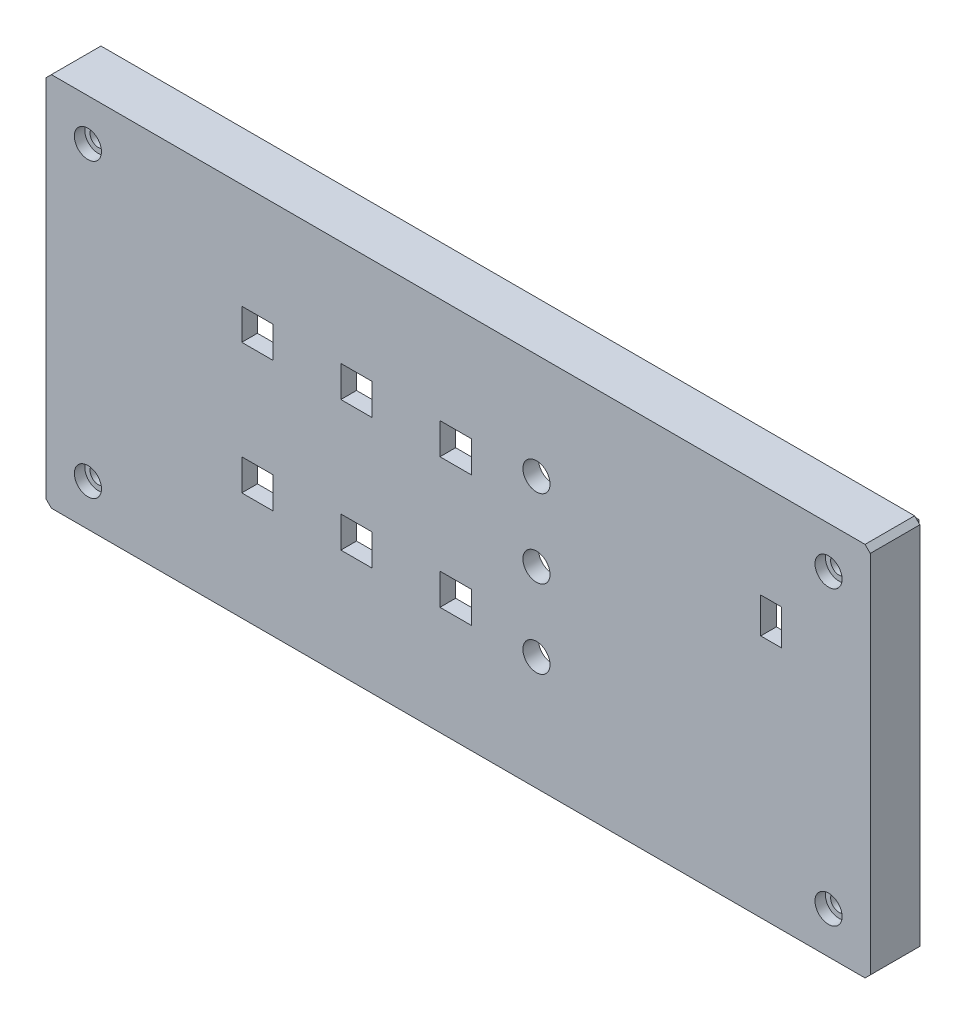
from build123d import *

# Parameters (mm, degrees)
SKETCH1_W                 = 158
SKETCH1_H                 = 72
SKETCH1_W_2               = 154
SKETCH1_H_2               = 68
BOSS_EXTRUDE1_DEPTH       = 6.5
SKETCH2_W                 = 158
SKETCH2_H                 = 72
BOSS_EXTRUDE2_DEPTH       = 3
SKETCH3_W                 = 6
SKETCH3_H                 = 6
SKETCH3_R                 = 2.6
CUT_EXTRUDE1_DEPTH        = 88.334128495
SKETCH5_W                 = 4
SKETCH5_H                 = 6.8
CUT_EXTRUDE7_DEPTH        = 3
SKETCH6_W                 = 155.6
SKETCH6_H                 = 69.6
SKETCH6_W_2               = 154
SKETCH6_H_2               = 68
BOSS_EXTRUDE3_DEPTH       = 1
SKETCH7_W                 = 10.3
SKETCH7_H                 = 10.3
SKETCH7_W_2               = 8.3
SKETCH7_H_2               = 8.3
BOSS_EXTRUDE4_DEPTH       = 1
LPATTERN1_COUNT           = 3
LPATTERN1_PITCH           = 19
LPATTERN1_COUNT_DIR2      = 2
LPATTERN1_PITCH_DIR2      = 25
SKETCH1_3_R               = 3
SKETCH1_3_R_2             = 1.6
BOSS_EXTRUDE5_DEPTH       = 6.5
CUT_EXTRUDE8_DEPTH        = 88.334128495
CUT_EXTRUDE8_DEPTH_BACK   = 88.334128495
SKETCH1_4_R               = 1.6
CHAMFER1_SIZE             = 1
CUT_EXTRUDE9_START        = -2
SKETCH8_R                 = 2.6
SKETCH8_R_2               = 1.6
CUT_EXTRUDE9_DEPTH        = 2
LPATTERN2_COUNT           = 2
LPATTERN2_PITCH           = 142
LPATTERN2_COUNT_DIR2      = 2
LPATTERN2_PITCH_DIR2      = 56
RIB1_REACH                = 104.114
SKETCH10_WALL_W           = 210.13293881
SKETCH10_WALL_H           = 2
CIRPATTERN1_COUNT         = 4
LPATTERN3_COUNT           = 2
LPATTERN3_PITCH           = 56
LPATTERN3_COUNT_DIR2      = 2
LPATTERN3_PITCH_DIR2      = 142
LPATTERN3_COPY_1_REACH    = 104.114
LPATTERN3_COPY_1_SKETCH_W = 210.13293881
LPATTERN3_COPY_1_SKETCH_H = 2
LPATTERN3_COPY_2_REACH    = 104.114
LPATTERN3_COPY_2_SKETCH_W = 210.13293881
LPATTERN3_COPY_2_SKETCH_H = 2
LPATTERN3_COPY_3_REACH    = 104.114
LPATTERN3_COPY_3_SKETCH_W = 210.13293881
LPATTERN3_COPY_3_SKETCH_H = 2
LPATTERN3_COPY_4_REACH    = 104.114
LPATTERN3_COPY_4_SKETCH_W = 210.13293881
LPATTERN3_COPY_4_SKETCH_H = 2
LPATTERN3_COPY_5_REACH    = 104.114
LPATTERN3_COPY_5_SKETCH_W = 210.13293881
LPATTERN3_COPY_5_SKETCH_H = 2
LPATTERN3_COPY_6_REACH    = 104.114
LPATTERN3_COPY_6_SKETCH_W = 210.13293881
LPATTERN3_COPY_6_SKETCH_H = 2
LPATTERN3_COPY_7_REACH    = 104.114
LPATTERN3_COPY_7_SKETCH_W = 210.13293881
LPATTERN3_COPY_7_SKETCH_H = 2
LPATTERN3_COPY_8_REACH    = 104.114
LPATTERN3_COPY_8_SKETCH_W = 210.13293881
LPATTERN3_COPY_8_SKETCH_H = 2
LPATTERN3_COPY_9_REACH    = 104.114
LPATTERN3_COPY_9_SKETCH_W = 210.13293881
LPATTERN3_COPY_9_SKETCH_H = 2


with BuildPart() as part:
    # Sketch1 → Boss-Extrude1 (new body)
    with BuildSketch(Plane.XY):
        Rectangle(SKETCH1_W, SKETCH1_H)
        Rectangle(SKETCH1_W_2, SKETCH1_H_2, mode=Mode.SUBTRACT)
    extrude(amount=BOSS_EXTRUDE1_DEPTH)

    # Sketch2 → Boss-Extrude2 (add)
    with BuildSketch(Plane.XY.offset(6.5)):
        Rectangle(SKETCH2_W, SKETCH2_H)
    extrude(amount=BOSS_EXTRUDE2_DEPTH)

    # Sketch3 → Cut-Extrude1 (cut, through all)
    with BuildSketch(Plane.XY.offset(9.5)):
        with Locations((-19.5, -12.2)):
            Rectangle(SKETCH3_W, SKETCH3_H)
        with Locations((-38.5, -12.2)):
            Rectangle(SKETCH3_W, SKETCH3_H)
        with Locations((-38.5, 12.8)):
            Rectangle(SKETCH3_W, SKETCH3_H)
        with Locations((-19.5, 12.8)):
            Rectangle(SKETCH3_W, SKETCH3_H)
        with Locations((15, -14.2)):
            Circle(SKETCH3_R)
        with Locations((15, 0.8)):
            Circle(SKETCH3_R)
        with Locations((-0.5, 12.8)):
            Rectangle(SKETCH3_W, SKETCH3_H)
        with Locations((15, 15.8)):
            Circle(SKETCH3_R)
        with Locations((-0.5, -12.2)):
            Rectangle(SKETCH3_W, SKETCH3_H)
    extrude(amount=-CUT_EXTRUDE1_DEPTH, mode=Mode.SUBTRACT)

    # Sketch5 → Cut-Extrude7 (cut)
    with BuildSketch(Plane.XY.offset(9.5)):
        with Locations((60, 14.2)):
            Rectangle(SKETCH5_W, SKETCH5_H)
    extrude(amount=-CUT_EXTRUDE7_DEPTH, mode=Mode.SUBTRACT)

    # Sketch6 → Boss-Extrude3 (add)
    with BuildSketch(Plane(origin=(0, 0, 0), x_dir=(-1, 0, 0), z_dir=(0, 0, -1))):
        Rectangle(SKETCH6_W, SKETCH6_H)
        Rectangle(SKETCH6_W_2, SKETCH6_H_2, mode=Mode.SUBTRACT)
    extrude(amount=BOSS_EXTRUDE3_DEPTH)

    # Sketch7 → Boss-Extrude4 (add)
    with BuildSketch(Plane(origin=(0, 0, 6.5), x_dir=(-1, 0, 0), z_dir=(0, 0, -1))):
        with Locations((0.5, 12.8)):
            Rectangle(SKETCH7_W, SKETCH7_H)
        with Locations((0.5, 12.8)):
            Rectangle(SKETCH7_W_2, SKETCH7_H_2, mode=Mode.SUBTRACT)
    boss_extrude4 = extrude(amount=BOSS_EXTRUDE4_DEPTH)

    # LPattern1: Boss-Extrude4 3 × 2
    with Locations(*[(-i * LPATTERN1_PITCH, -j * LPATTERN1_PITCH_DIR2, 0) for i in range(LPATTERN1_COUNT) for j in range(LPATTERN1_COUNT_DIR2) if (i, j) != (0, 0)]):
        add(boss_extrude4)

    # Sketch1<3> → Boss-Extrude5 (add)
    # profile 1 of 4: a face of its own
    with BuildSketch(Plane.XY):
        with Locations((71, 28)):
            Circle(SKETCH1_3_R)
        with Locations((71, 28)):
            Circle(SKETCH1_3_R_2, mode=Mode.SUBTRACT)
    # profile 2 of 4: a face of its own
    with BuildSketch(Plane.XY):
        with Locations((-71, 28)):
            Circle(SKETCH1_3_R)
        with Locations((-71, 28)):
            Circle(SKETCH1_3_R_2, mode=Mode.SUBTRACT)
    # profile 3 of 4: a face of its own
    with BuildSketch(Plane.XY):
        with Locations((-71, -28)):
            Circle(SKETCH1_3_R)
        with Locations((-71, -28)):
            Circle(SKETCH1_3_R_2, mode=Mode.SUBTRACT)
    # profile 4 of 4: a face of its own
    with BuildSketch(Plane.XY):
        with Locations((71, -28)):
            Circle(SKETCH1_3_R)
        with Locations((71, -28)):
            Circle(SKETCH1_3_R_2, mode=Mode.SUBTRACT)
    extrude(amount=BOSS_EXTRUDE5_DEPTH)

    # Sketch1<4> → Cut-Extrude8 (cut, two sides: drawn at the far end of the back side and taken through both)
    with BuildSketch(Plane.XY.offset(-CUT_EXTRUDE8_DEPTH_BACK)):
        with Locations((-71, 28)):
            Circle(SKETCH1_4_R)
        with Locations((-71, -28)):
            Circle(SKETCH1_4_R)
        with Locations((71, -28)):
            Circle(SKETCH1_4_R)
        with Locations((71, 28)):
            Circle(SKETCH1_4_R)
    extrude(amount=CUT_EXTRUDE8_DEPTH + CUT_EXTRUDE8_DEPTH_BACK, mode=Mode.SUBTRACT)

    # Chamfer1
    chamfer1_edges = [part.edges().sort_by_distance(p)[0] for p in [
        (79, 36, 4.75),
        (79, -36, 4.75),
        (-79, -36, 4.75),
        (-79, 36, 4.75),
    ]]
    chamfer(chamfer1_edges, length=CHAMFER1_SIZE)

    # Sketch8 → Cut-Extrude9 (cut)
    with BuildSketch(Plane.XY.offset(9.5).offset(CUT_EXTRUDE9_START)):
        with Locations((-71, 28)):
            Circle(SKETCH8_R)
        with Locations((-71, 28)):
            Circle(SKETCH8_R_2, mode=Mode.SUBTRACT)
    cut_extrude9 = extrude(amount=CUT_EXTRUDE9_DEPTH, mode=Mode.SUBTRACT)

    # LPattern2: Cut-Extrude9 2 × 2
    with Locations(*[(i * LPATTERN2_PITCH, -j * LPATTERN2_PITCH_DIR2, 0) for i in range(LPATTERN2_COUNT) for j in range(LPATTERN2_COUNT_DIR2) if (i, j) != (0, 0)]):
        add(cut_extrude9, mode=Mode.SUBTRACT)

    # Sketch10 wall → Rib1 (add, up to next)
    with BuildSketch(Plane(origin=(-67.25, 28, 5), x_dir=(0.640184399664, 0, 0.768221279597), z_dir=(0.768221279597, 0, -0.640184399664)), mode=Mode.PRIVATE) as rib1_sk1:
        Rectangle(SKETCH10_WALL_W, SKETCH10_WALL_H)
    rib1_tool1 = extrude(rib1_sk1.sketch, amount=-RIB1_REACH, mode=Mode.PRIVATE) - part.part
    rib1 = rib1_tool1.solids().sort_by_distance((-67.25, 28, 5))[0]
    add(rib1)

    # CirPattern1: Rib1 ×4 about axis
    cirpattern1_axis = Axis((-71, 28, 0), (0, 0, 1))
    for i in range(1, CIRPATTERN1_COUNT):
        add(rib1.rotate(cirpattern1_axis, i * 360 / CIRPATTERN1_COUNT))

    # LPattern3: Rib1 2 × 2
    with Locations(*[(j * LPATTERN3_PITCH_DIR2, -i * LPATTERN3_PITCH, 0) for i in range(LPATTERN3_COUNT) for j in range(LPATTERN3_COUNT_DIR2) if (i, j) != (0, 0)]):
        add(rib1)

    # LPattern3 copy 1 sketch → LPattern3 copy 1 (add, up to next)
    with BuildSketch(Plane(origin=(71, 31.75, 5), x_dir=(0, 0.640184399664, 0.768221279597), z_dir=(0, 0.768221279597, -0.640184399664)), mode=Mode.PRIVATE) as lpattern3_copy_1_sk1:
        Rectangle(LPATTERN3_COPY_1_SKETCH_W, LPATTERN3_COPY_1_SKETCH_H)
    lpattern3_copy_1_tool1 = extrude(lpattern3_copy_1_sk1.sketch, amount=-LPATTERN3_COPY_1_REACH, mode=Mode.PRIVATE) - part.part
    add(lpattern3_copy_1_tool1.solids().sort_by_distance((71, 31.75, 5))[0])

    # LPattern3 copy 2 sketch → LPattern3 copy 2 (add, up to next)
    with BuildSketch(Plane(origin=(-71, -24.25, 5), x_dir=(0, 0.640184399664, 0.768221279597), z_dir=(0, 0.768221279597, -0.640184399664)), mode=Mode.PRIVATE) as lpattern3_copy_2_sk1:
        Rectangle(LPATTERN3_COPY_2_SKETCH_W, LPATTERN3_COPY_2_SKETCH_H)
    lpattern3_copy_2_tool1 = extrude(lpattern3_copy_2_sk1.sketch, amount=-LPATTERN3_COPY_2_REACH, mode=Mode.PRIVATE) - part.part
    add(lpattern3_copy_2_tool1.solids().sort_by_distance((-71, -24.25, 5))[0])

    # LPattern3 copy 3 sketch → LPattern3 copy 3 (add, up to next)
    with BuildSketch(Plane(origin=(71, -24.25, 5), x_dir=(0, 0.640184399664, 0.768221279597), z_dir=(0, 0.768221279597, -0.640184399664)), mode=Mode.PRIVATE) as lpattern3_copy_3_sk1:
        Rectangle(LPATTERN3_COPY_3_SKETCH_W, LPATTERN3_COPY_3_SKETCH_H)
    lpattern3_copy_3_tool1 = extrude(lpattern3_copy_3_sk1.sketch, amount=-LPATTERN3_COPY_3_REACH, mode=Mode.PRIVATE) - part.part
    add(lpattern3_copy_3_tool1.solids().sort_by_distance((71, -24.25, 5))[0])

    # LPattern3 copy 4 sketch → LPattern3 copy 4 (add, up to next)
    with BuildSketch(Plane(origin=(67.25, 28, 5), x_dir=(-0.640184399664, 0, 0.768221279597), z_dir=(-0.768221279597, 0, -0.640184399664)), mode=Mode.PRIVATE) as lpattern3_copy_4_sk1:
        Rectangle(LPATTERN3_COPY_4_SKETCH_W, LPATTERN3_COPY_4_SKETCH_H)
    lpattern3_copy_4_tool1 = extrude(lpattern3_copy_4_sk1.sketch, amount=-LPATTERN3_COPY_4_REACH, mode=Mode.PRIVATE) - part.part
    add(lpattern3_copy_4_tool1.solids().sort_by_distance((67.25, 28, 5))[0])

    # LPattern3 copy 5 sketch → LPattern3 copy 5 (add, up to next)
    with BuildSketch(Plane(origin=(-74.75, -28, 5), x_dir=(-0.640184399664, 0, 0.768221279597), z_dir=(-0.768221279597, 0, -0.640184399664)), mode=Mode.PRIVATE) as lpattern3_copy_5_sk1:
        Rectangle(LPATTERN3_COPY_5_SKETCH_W, LPATTERN3_COPY_5_SKETCH_H)
    lpattern3_copy_5_tool1 = extrude(lpattern3_copy_5_sk1.sketch, amount=-LPATTERN3_COPY_5_REACH, mode=Mode.PRIVATE) - part.part
    add(lpattern3_copy_5_tool1.solids().sort_by_distance((-74.75, -28, 5))[0])

    # LPattern3 copy 6 sketch → LPattern3 copy 6 (add, up to next)
    with BuildSketch(Plane(origin=(67.25, -28, 5), x_dir=(-0.640184399664, 0, 0.768221279597), z_dir=(-0.768221279597, 0, -0.640184399664)), mode=Mode.PRIVATE) as lpattern3_copy_6_sk1:
        Rectangle(LPATTERN3_COPY_6_SKETCH_W, LPATTERN3_COPY_6_SKETCH_H)
    lpattern3_copy_6_tool1 = extrude(lpattern3_copy_6_sk1.sketch, amount=-LPATTERN3_COPY_6_REACH, mode=Mode.PRIVATE) - part.part
    add(lpattern3_copy_6_tool1.solids().sort_by_distance((67.25, -28, 5))[0])

    # LPattern3 copy 7 sketch → LPattern3 copy 7 (add, up to next)
    with BuildSketch(Plane(origin=(71, 24.25, 5), x_dir=(0, -0.640184399664, 0.768221279597), z_dir=(0, -0.768221279597, -0.640184399664)), mode=Mode.PRIVATE) as lpattern3_copy_7_sk1:
        Rectangle(LPATTERN3_COPY_7_SKETCH_W, LPATTERN3_COPY_7_SKETCH_H)
    lpattern3_copy_7_tool1 = extrude(lpattern3_copy_7_sk1.sketch, amount=-LPATTERN3_COPY_7_REACH, mode=Mode.PRIVATE) - part.part
    add(lpattern3_copy_7_tool1.solids().sort_by_distance((71, 24.25, 5))[0])

    # LPattern3 copy 8 sketch → LPattern3 copy 8 (add, up to next)
    with BuildSketch(Plane(origin=(-71, -31.75, 5), x_dir=(0, -0.640184399664, 0.768221279597), z_dir=(0, -0.768221279597, -0.640184399664)), mode=Mode.PRIVATE) as lpattern3_copy_8_sk1:
        Rectangle(LPATTERN3_COPY_8_SKETCH_W, LPATTERN3_COPY_8_SKETCH_H)
    lpattern3_copy_8_tool1 = extrude(lpattern3_copy_8_sk1.sketch, amount=-LPATTERN3_COPY_8_REACH, mode=Mode.PRIVATE) - part.part
    add(lpattern3_copy_8_tool1.solids().sort_by_distance((-71, -31.75, 5))[0])

    # LPattern3 copy 9 sketch → LPattern3 copy 9 (add, up to next)
    with BuildSketch(Plane(origin=(71, -31.75, 5), x_dir=(0, -0.640184399664, 0.768221279597), z_dir=(0, -0.768221279597, -0.640184399664)), mode=Mode.PRIVATE) as lpattern3_copy_9_sk1:
        Rectangle(LPATTERN3_COPY_9_SKETCH_W, LPATTERN3_COPY_9_SKETCH_H)
    lpattern3_copy_9_tool1 = extrude(lpattern3_copy_9_sk1.sketch, amount=-LPATTERN3_COPY_9_REACH, mode=Mode.PRIVATE) - part.part
    add(lpattern3_copy_9_tool1.solids().sort_by_distance((71, -31.75, 5))[0])


solid = part.part
